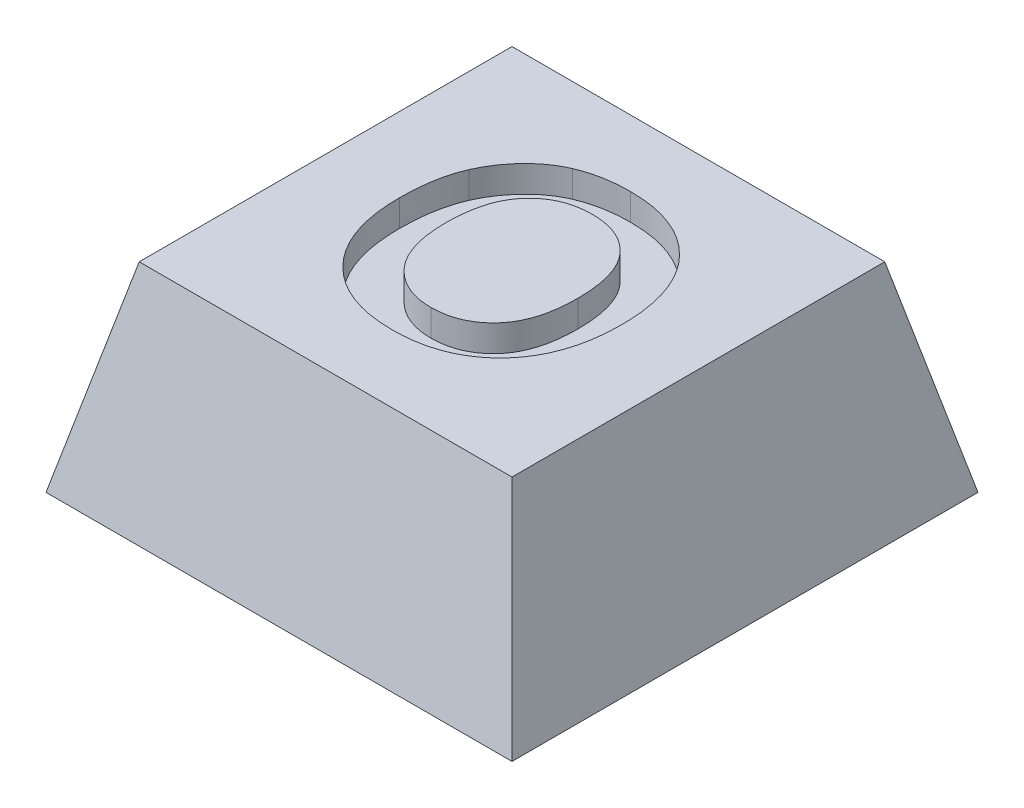
from build123d import *

# Parameters (mm, degrees)
SKETCH1_W           = 7
SKETCH1_H           = 7
BOSS_EXTRUDE1_DEPTH = 3
CUT_EXTRUDE1_DEPTH  = 7
CUT_EXTRUDE2_DEPTH  = 11
SKETCH4_R           = 1.8
CUT_EXTRUDE3_DEPTH  = 0.8
CUT_EXTRUDE4_DEPTH  = 0.4


with BuildPart() as part:
    # Sketch1 → Boss-Extrude1 (new body)
    with BuildSketch(Plane(origin=(0, 0, 0), x_dir=(1, 0, 0), z_dir=(0, 1, 0))):
        with Locations((3.5, 3.5)):
            Rectangle(SKETCH1_W, SKETCH1_H)
    extrude(amount=BOSS_EXTRUDE1_DEPTH)

    # Sketch2 → Cut-Extrude1 (cut)
    with BuildSketch(Plane.XY):
        Polygon((0, 0), (0.7, 3), (0, 3), align=None)
        Polygon((7, 0), (6.3, 3), (7, 3), align=None)
    extrude(amount=-CUT_EXTRUDE1_DEPTH, mode=Mode.SUBTRACT)

    # Sketch3 → Cut-Extrude2 (cut)
    with BuildSketch(Plane(origin=(0, 0, 0), x_dir=(0, 0, -1), z_dir=(1, 0, 0))):
        Polygon((0, 0), (0.7, 3), (0, 3), align=None)
        Polygon((7, 3), (6.3, 3), (7, 0), align=None)
    extrude(amount=CUT_EXTRUDE2_DEPTH, mode=Mode.SUBTRACT)

    # Sketch4 → Cut-Extrude3 (cut)
    with BuildSketch(Plane.XZ):
        with Locations(Location((3.5, -3.5, 0), (0, 0, 270))):
            Circle(SKETCH4_R)
    extrude(amount=-CUT_EXTRUDE3_DEPTH, mode=Mode.SUBTRACT)

    # Sketch5 → Cut-Extrude4 (cut)
    with BuildSketch(Plane(origin=(0, 3, 0), x_dir=(1, 0, 0), z_dir=(0, 1, 0))):
        with BuildLine():
            add(Edge.make_bspline(
                [(1.821714103, 3.488248698), (1.821961784, 3.531500253), (1.822448196, 3.616440725), (1.830876604, 3.741051587), (1.841985901, 3.86049575), (1.860077374, 3.974303397), (1.881359551, 4.083007187), (1.907977906, 4.186574853), (1.940043598, 4.284643186), (1.96555211, 4.347258757), (1.978064263, 4.377972255)],
                knots=[0, 0, 0, 0, 1.141009212, 2.240794809, 3.294380675, 4.305229195, 5.280013876, 6.216333343, 7.125095522, 8, 8, 8, 8], degree=3))
            add(Edge.make_bspline(
                [(1.978064263, 4.377972255), (1.998516886, 4.421635051), (2.039181575, 4.508447097), (2.114702293, 4.631119496), (2.200300575, 4.746809508), (2.295271713, 4.854910638), (2.397191064, 4.953795484), (2.506539435, 5.038426674), (2.619432008, 5.111662383), (2.699724257, 5.148495592), (2.739482532, 5.166734275)],
                knots=[0, 0, 0, 0, 1.031372299, 2.050613973, 3.077158538, 4.108712802, 5.127684358, 6.111366908, 7.06480644, 8, 8, 8, 8], degree=3))
            add(Edge.make_bspline(
                [(2.739482532, 5.166734275), (2.766470301, 5.177804055), (2.821019461, 5.200178904), (2.905795278, 5.228103887), (2.993787729, 5.250791674), (3.084360371, 5.271071912), (3.178392588, 5.285055803), (3.27512456, 5.296780816), (3.375085669, 5.302926099), (3.442700631, 5.303740345), (3.47706266, 5.304154146)],
                knots=[0, 0, 0, 0, 0.92659354, 1.872881803, 2.832850937, 3.813025581, 4.820167273, 5.851730198, 6.908245912, 8, 8, 8, 8], degree=3))
            add(Edge.make_bspline(
                [(3.47706266, 5.304154146), (3.538590536, 5.302611845), (3.659001433, 5.299593539), (3.834887941, 5.277792675), (4.001329981, 5.240979909), (4.157764144, 5.187771817), (4.305539157, 5.121260548), (4.443506895, 5.038760892), (4.571871554, 4.941165749), (4.690385205, 4.829813461), (4.797115236, 4.704898086), (4.890068226, 4.567586522), (4.968043218, 4.418522223), (5.032260126, 4.258116463), (5.081605981, 4.085845307), (5.117258315, 3.902194835), (5.138438688, 3.707029775), (5.140941529, 3.573137898), (5.142226923, 3.504374499)],
                knots=[0, 0, 0, 0, 1.064641025, 2.083517118, 3.061799897, 4.009540929, 4.938075217, 5.861300345, 6.78508344, 7.723570974, 8.670267188, 9.622657076, 10.586935816, 11.576069104, 12.607749008, 13.683335114, 14.81022093, 16, 16, 16, 16], degree=3))
            add(Edge.make_bspline(
                [(5.142226923, 3.504374499), (5.140971218, 3.436071549), (5.138526593, 3.303098467), (5.116950876, 3.109464875), (5.082776635, 2.92715322), (5.032236807, 2.75657997), (4.969936504, 2.596443536), (4.89115913, 2.448651271), (4.800152856, 2.311242808), (4.693574415, 2.187673494), (4.577055417, 2.075682155), (4.448853581, 1.979227653), (4.31189018, 1.896616215), (4.164920865, 1.829912739), (4.008903554, 1.777800449), (3.843329096, 1.740704804), (3.668112571, 1.718987832), (3.548170832, 1.715958568), (3.486878366, 1.714410557)],
                knots=[0, 0, 0, 0, 1.18845052, 2.313691126, 3.386664782, 4.412527756, 5.405809582, 6.372003093, 7.321919452, 8.268293321, 9.206237639, 10.129603466, 11.054616372, 11.9847576, 12.932764752, 13.912672021, 14.933336461, 16, 16, 16, 16], degree=3))
            add(Edge.make_bspline(
                [(3.486878366, 1.714410557), (3.424885779, 1.71596214), (3.303548476, 1.718999034), (3.126463104, 1.7406499), (2.959245037, 1.777757756), (2.802013351, 1.830053351), (2.653695695, 1.895743521), (2.51566143, 1.97751079), (2.387834254, 2.074576155), (2.270341671, 2.185249258), (2.163829132, 2.308455276), (2.072952075, 2.444980241), (1.994170592, 2.591328945), (1.931542745, 2.74971822), (1.881281222, 2.918518444), (1.847023473, 3.098700906), (1.825406036, 3.289769697), (1.822967241, 3.420879762), (1.821714103, 3.488248698)],
                knots=[0, 0, 0, 0, 1.080878253, 2.11558926, 3.1052859, 4.062802436, 5.000434901, 5.928596448, 6.853693179, 7.793554778, 8.738606028, 9.68692032, 10.647726704, 11.63151566, 12.651483354, 13.714466703, 14.825613081, 16, 16, 16, 16], degree=3))
        make_face()
        with BuildLine():
            add(Edge.make_bspline(
                [(2.494791026, 3.511385717), (2.495463421, 3.46297147), (2.496765502, 3.369218203), (2.510634389, 3.233137604), (2.531681539, 3.105921329), (2.562634465, 2.987713764), (2.601737596, 2.878429396), (2.649647038, 2.77797681), (2.7061648, 2.686206391), (2.772752717, 2.605055542), (2.844795621, 2.532603477), (2.92255951, 2.469914167), (3.004595136, 2.415957097), (3.092321967, 2.373358172), (3.183914249, 2.339551264), (3.280083591, 2.31448468), (3.381308169, 2.300720664), (3.450381011, 2.298746792), (3.485476122, 2.29774389)],
                knots=[0, 0, 0, 0, 1.313550922, 2.543666373, 3.708465049, 4.810029406, 5.85539231, 6.85404609, 7.825601258, 8.772642133, 9.696587791, 10.59409323, 11.479048685, 12.35559886, 13.234601248, 14.125357077, 15.047515647, 16, 16, 16, 16], degree=3))
            add(Edge.make_bspline(
                [(3.485476122, 2.29774389), (3.520575961, 2.298726471), (3.589658109, 2.30066035), (3.690758312, 2.31470579), (3.787118236, 2.338697967), (3.878346649, 2.372331634), (3.964859358, 2.415606978), (4.046581009, 2.468354444), (4.123040539, 2.531328963), (4.195005026, 2.602728481), (4.259795575, 2.684418325), (4.315832134, 2.776172907), (4.363717971, 2.877234741), (4.40282522, 2.987641635), (4.433016388, 3.107601318), (4.453204553, 3.23717726), (4.467185589, 3.375998963), (4.46848236, 3.471851744), (4.46915, 3.521201422)],
                knots=[0, 0, 0, 0, 0.949153107, 1.868086493, 2.754172764, 3.630100905, 4.492260106, 5.365378617, 6.254840125, 7.166615376, 8.102436631, 9.067266169, 10.06813181, 11.121736829, 12.23011542, 13.408501285, 14.665770308, 16, 16, 16, 16], degree=3))
            add(Edge.make_bspline(
                [(4.46915, 3.521201422), (4.468395892, 3.570074602), (4.466935489, 3.66472216), (4.45421689, 3.801791371), (4.433386174, 3.929313247), (4.404429177, 4.047254755), (4.366160687, 4.155634899), (4.320453453, 4.254750055), (4.265186916, 4.344082401), (4.20180297, 4.423585682), (4.131665715, 4.493563899), (4.055966759, 4.554826829), (3.974276008, 4.605801311), (3.88739075, 4.648689422), (3.794406419, 4.680507955), (3.696267954, 4.703716125), (3.592697629, 4.718007752), (3.521746781, 4.719869217), (3.485476122, 4.720820813)],
                knots=[0, 0, 0, 0, 1.332337092, 2.580197383, 3.749299508, 4.852775005, 5.886662144, 6.878700295, 7.822989687, 8.743523536, 9.644687758, 10.519443927, 11.392806431, 12.264866173, 13.155606721, 14.065961015, 15.011303331, 16, 16, 16, 16], degree=3))
            add(Edge.make_bspline(
                [(3.485476122, 4.720820813), (3.449200879, 4.719883854), (3.378241063, 4.718051022), (3.274509295, 4.703522778), (3.176061662, 4.681006152), (3.083090474, 4.647370777), (2.995448418, 4.604894527), (2.913459658, 4.552215512), (2.836478148, 4.49105655), (2.765712484, 4.420017304), (2.701301518, 4.339817822), (2.646008366, 4.249393926), (2.598858806, 4.149733156), (2.560175326, 4.040540508), (2.531498905, 3.9215156), (2.509458688, 3.79345835), (2.49708172, 3.655593683), (2.495571002, 3.560488178), (2.494791026, 3.511385717)],
                knots=[0, 0, 0, 0, 0.981996942, 1.920933313, 2.83127778, 3.712125466, 4.592427284, 5.463259035, 6.34592384, 7.249932058, 8.173122297, 9.125107726, 10.113123258, 11.154048744, 12.256187849, 13.424658091, 14.670364834, 16, 16, 16, 16], degree=3))
        make_face(mode=Mode.SUBTRACT)
    extrude(amount=-CUT_EXTRUDE4_DEPTH, mode=Mode.SUBTRACT)


solid = part.part
